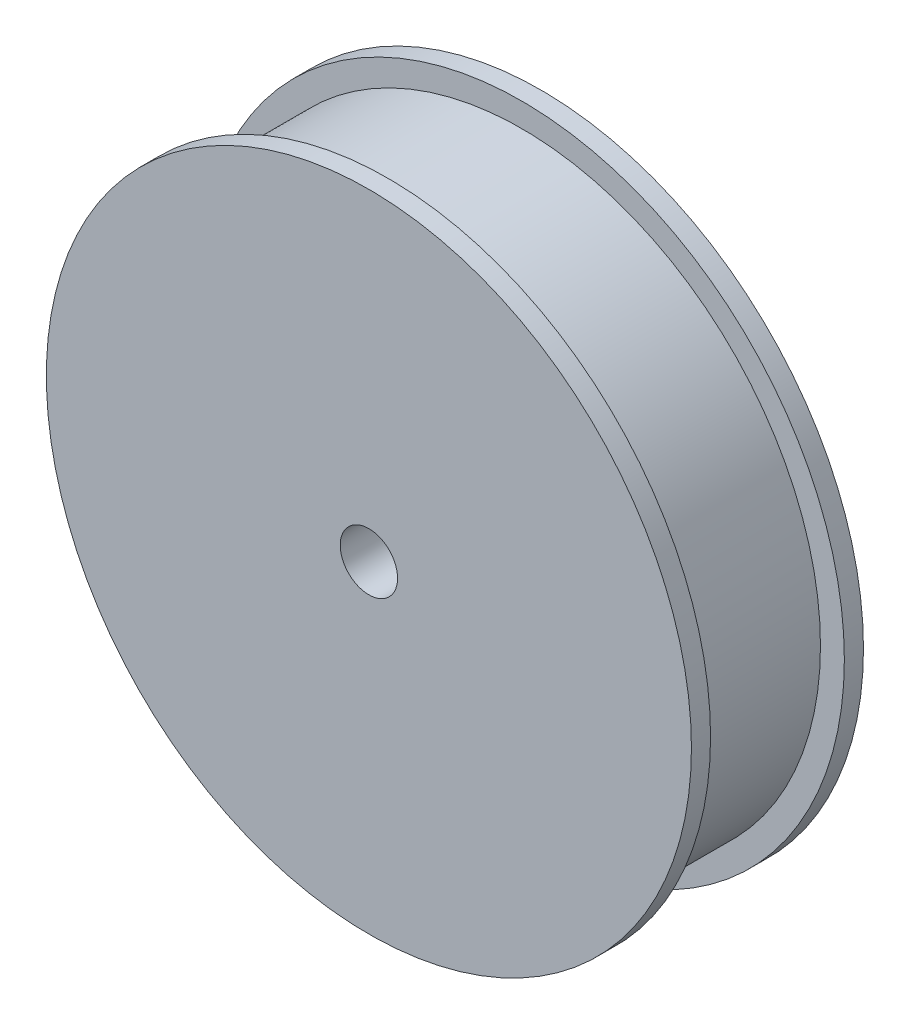
from build123d import *

# Parameters (mm, degrees)
SKETCH1_R           = 31.25
SKETCH1_R_2         = 3
BOSS_EXTRUDE1_DEPTH = 8
SKETCH2_R           = 33.75
SKETCH2_R_2         = 3
BOSS_EXTRUDE2_DEPTH = 1


with BuildPart() as part:
    # Sketch1 → Boss-Extrude1 (new, symmetric)
    with BuildSketch(Plane.XY):
        Circle(SKETCH1_R)
        Circle(SKETCH1_R_2, mode=Mode.SUBTRACT)
    extrude(amount=BOSS_EXTRUDE1_DEPTH, both=True)

    # Sketch2 → Boss-Extrude2 (add, symmetric)
    with BuildSketch(Plane.XY.offset(8)):
        Circle(SKETCH2_R)
        Circle(SKETCH2_R_2, mode=Mode.SUBTRACT)
    boss_extrude2 = extrude(amount=BOSS_EXTRUDE2_DEPTH, both=True)

    # Mirror1: Boss-Extrude2 across plane
    add(boss_extrude2.mirror(Plane.XY))


solid = part.part
